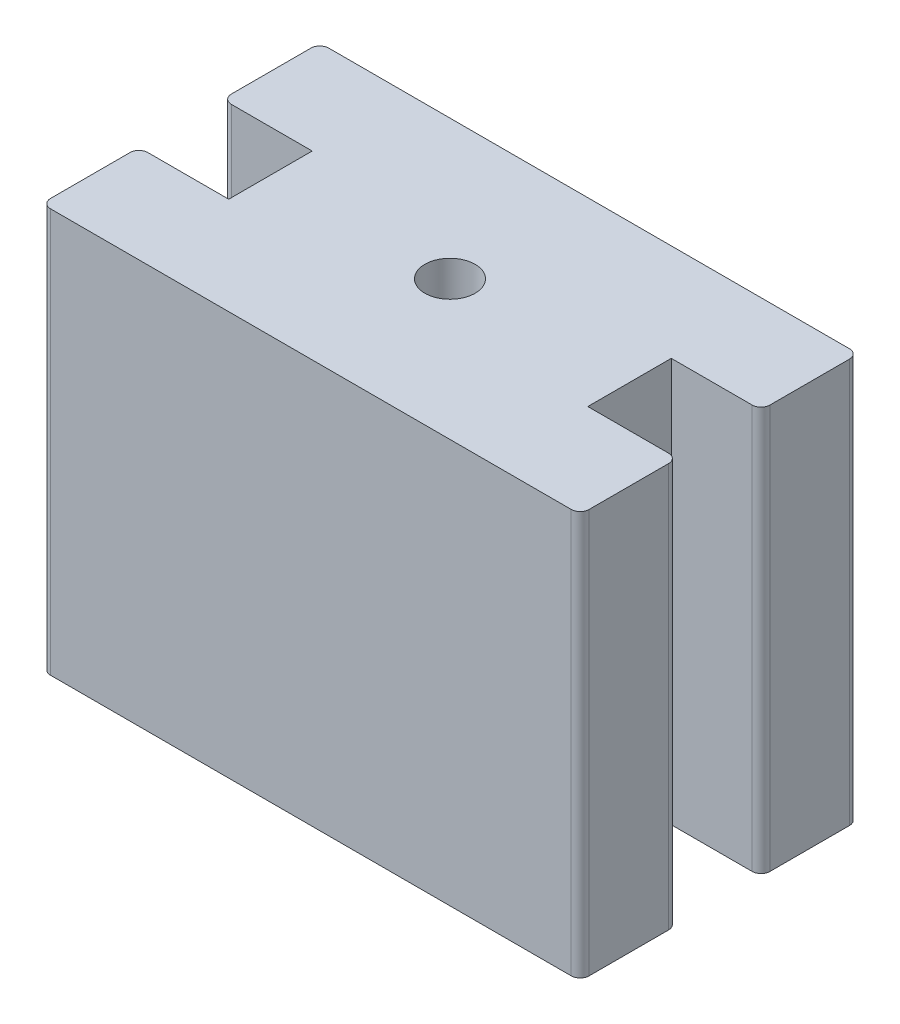
from build123d import *

# Parameters (mm, degrees)
SKETCH1_R           = 2.8
BOSS_EXTRUDE1_DEPTH = 45


with BuildPart() as part:
    # Sketch1 → Boss-Extrude1 (new body)
    with BuildSketch(Plane(origin=(0, 0, 0), x_dir=(1, 0, 0), z_dir=(0, 1, 0))):
        with BuildLine():
            Line((20, -4.65), (20, 4.65))
            Line((20, 4.65), (29, 4.65))
            ThreePointArc((29, 4.65), (29.707106781, 4.942893219), (30, 5.65))
            Line((30, 5.65), (30, 14.5))
            ThreePointArc((30, 14.5), (29.707106781, 15.207106781), (29, 15.5))
            Line((29, 15.5), (20, 15.5))
            Line((20, 15.5), (-20, 15.5))
            Line((-20, 15.5), (-29, 15.5))
            ThreePointArc((-29, 15.5), (-29.707106781, 15.207106781), (-30, 14.5))
            Line((-30, 14.5), (-30, 5.65))
            ThreePointArc((-30, 5.65), (-29.707106781, 4.942893219), (-29, 4.65))
            Line((-29, 4.65), (-20, 4.65))
            Line((-20, 4.65), (-20, -4.65))
            Line((-20, -4.65), (-29, -4.65))
            ThreePointArc((-29, -4.65), (-29.707106781, -4.942893219), (-30, -5.65))
            Line((-30, -5.65), (-30, -14.5))
            ThreePointArc((-30, -14.5), (-29.707106781, -15.207106781), (-29, -15.5))
            Line((-29, -15.5), (-20, -15.5))
            Line((-20, -15.5), (20, -15.5))
            Line((20, -15.5), (29, -15.5))
            ThreePointArc((29, -15.5), (29.707106781, -15.207106781), (30, -14.5))
            Line((30, -14.5), (30, -5.65))
            ThreePointArc((30, -5.65), (29.707106781, -4.942893219), (29, -4.65))
            Line((29, -4.65), (20, -4.65))
        make_face()
        with Locations(Location((0, 0, 0), (0, 0, 90))):
            Circle(SKETCH1_R, mode=Mode.SUBTRACT)
    extrude(amount=BOSS_EXTRUDE1_DEPTH)


solid = part.part
